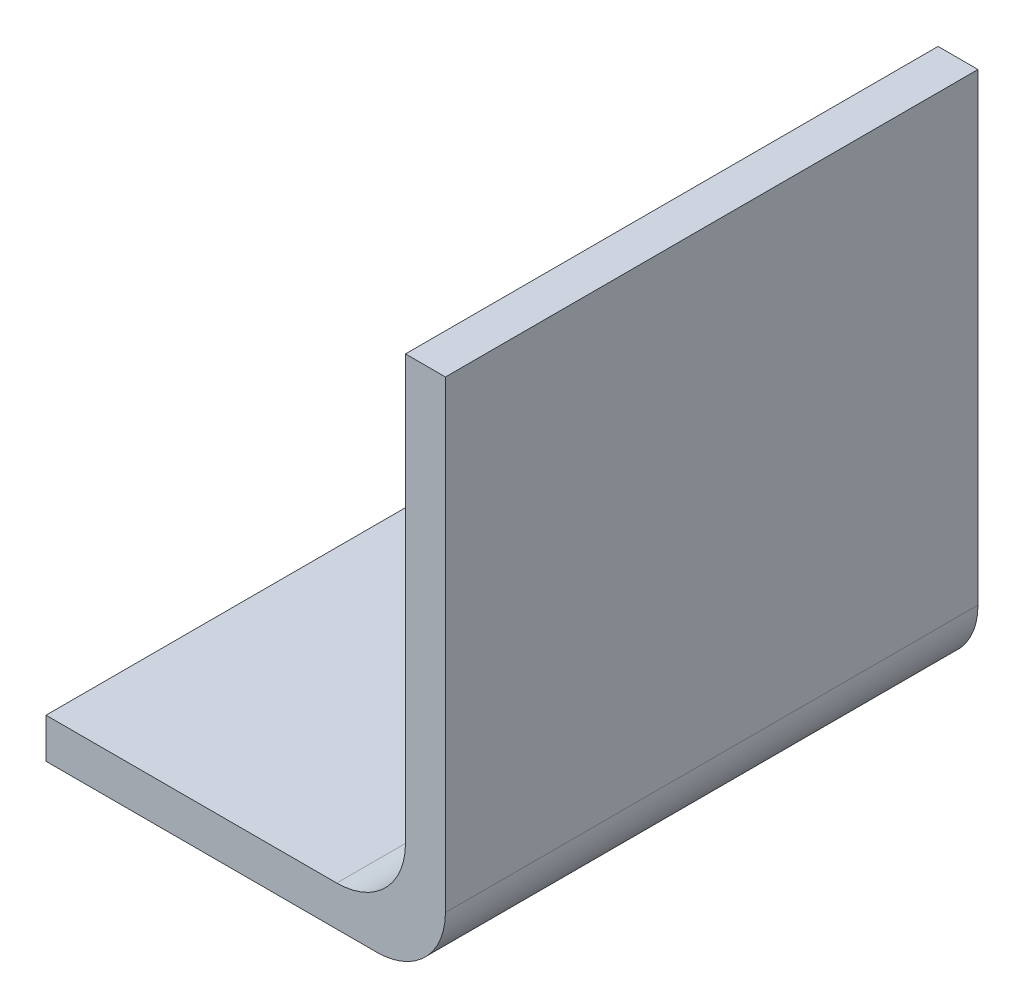
from build123d import *

# Parameters (mm, degrees)
BOSS_EXTRUDE1_DEPTH = 40
SKETCH3_R           = 5
CUT_EXTRUDE1_DEPTH  = 40


with BuildPart() as part:
    # Sketch2 → Boss-Extrude1 (new body)
    with BuildSketch(Plane.XY):
        with BuildLine():
            Line((0, 0), (24.836851576, 0))
            ThreePointArc((24.836851576, 0), (28.487748839, 1.512251161), (30, 5.163148424))
            Line((30, 5.163148424), (30, 40))
            Line((30, 40), (27, 40))
            Line((27, 40), (27, 8.163148424))
            ThreePointArc((27, 8.163148424), (25.487748839, 4.512251161), (21.836851576, 3))
            Line((21.836851576, 3), (0, 3))
            Line((0, 3), (0, 0))
        make_face()
    extrude(amount=BOSS_EXTRUDE1_DEPTH)

    # Sketch3 → Cut-Extrude1 (cut)
    with BuildSketch(Plane(origin=(0, 3, 0), x_dir=(1, 0, 0), z_dir=(0, 1, 0))):
        with Locations(Location((14.709726001, -20, 0), (0, 0, 180))):
            Circle(SKETCH3_R)
    extrude(amount=-CUT_EXTRUDE1_DEPTH, mode=Mode.SUBTRACT)


solid = part.part
